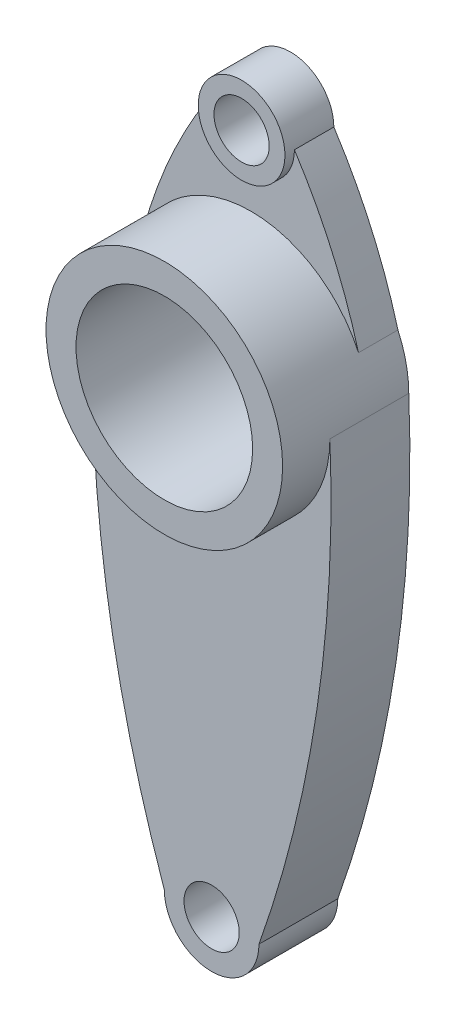
from build123d import *

# Parameters (mm, degrees)
SKETCH1_R           = 15
SKETCH1_R_2         = 11.2
BOSS_EXTRUDE1_DEPTH = 16
SKETCH2_R           = 5.5
SKETCH2_R_2         = 3.5
BOSS_EXTRUDE2_DEPTH = 5
SKETCH3_R           = 3.5
BOSS_EXTRUDE3_DEPTH = 10
SKETCH4_R           = 5.5
SKETCH4_R_2         = 3.5
BOSS_EXTRUDE4_DEPTH = 1.2


with BuildPart() as part:
    # Sketch1 → Boss-Extrude1 (new body)
    with BuildSketch(Plane.XY):
        Circle(SKETCH1_R)
        Circle(SKETCH1_R_2, mode=Mode.SUBTRACT)
    extrude(amount=BOSS_EXTRUDE1_DEPTH)

    # Sketch2 → Boss-Extrude2 (add)
    # profile 1 of 3: a face of its own
    with BuildSketch(Plane.XY):
        with Locations((-21.217622393, 12.25)):
            Circle(SKETCH2_R)
        with Locations((-21.217622393, 12.25)):
            Circle(SKETCH2_R_2, mode=Mode.SUBTRACT)
    # profile 2 of 3: a face of its own
    with BuildSketch(Plane.XY):
        with BuildLine():
            ThreePointArc((13.624389704, 6.275030295), (10.26570525, 15.701128433), (5.5, 24.5))
            ThreePointArc((5.5, 24.5), (0, 19), (-5.5, 24.5))
            ThreePointArc((-5.5, 24.5), (-10.26570525, 15.701128433), (-13.624389704, 6.275030295))
            ThreePointArc((-13.624389704, 6.275030295), (0, 15), (13.624389704, 6.275030295))
        make_face()
    # profile 3 of 3: a face of its own
    with BuildSketch(Plane.XY):
        with Locations((0, 24.5)):
            Circle(SKETCH2_R)
        with Locations(Location((0, 24.5, 0), (0, 0, 180))):
            Circle(SKETCH2_R_2, mode=Mode.SUBTRACT)
    extrude(amount=BOSS_EXTRUDE2_DEPTH)


with BuildPart() as boss_extrude2_kept_piece:
    # of the separate pieces the step leaves, the one the design keeps (boss_extrude2_pieces_kept)
    add(part.part.solids().sort_by_distance((15, 0, 0))[0])

    # Sketch3 → Boss-Extrude3 (add)
    with BuildSketch(Plane(origin=(0, 0, 0), x_dir=(-1, 0, 0), z_dir=(0, 0, -1))):
        with BuildLine():
            ThreePointArc((15, 0), (0, -15), (-15, 0))
            ThreePointArc((-15, 0), (-13.36999277, -30.430498916), (-6, -60))
            ThreePointArc((-6, -60), (0, -66), (6, -60))
            ThreePointArc((6, -60), (13.36999277, -30.430498916), (15, 0))
        make_face()
        with Locations((0, -60)):
            Circle(SKETCH3_R, mode=Mode.SUBTRACT)
    extrude(amount=-BOSS_EXTRUDE3_DEPTH)

    # Sketch4 → Boss-Extrude4 (add)
    with BuildSketch(Plane.XY.offset(5)):
        with Locations((0, 24.5)):
            Circle(SKETCH4_R)
        with Locations(Location((0, 24.5, 0), (0, 0, 180))):
            Circle(SKETCH4_R_2, mode=Mode.SUBTRACT)
    extrude(amount=BOSS_EXTRUDE4_DEPTH)


solid = boss_extrude2_kept_piece.part
